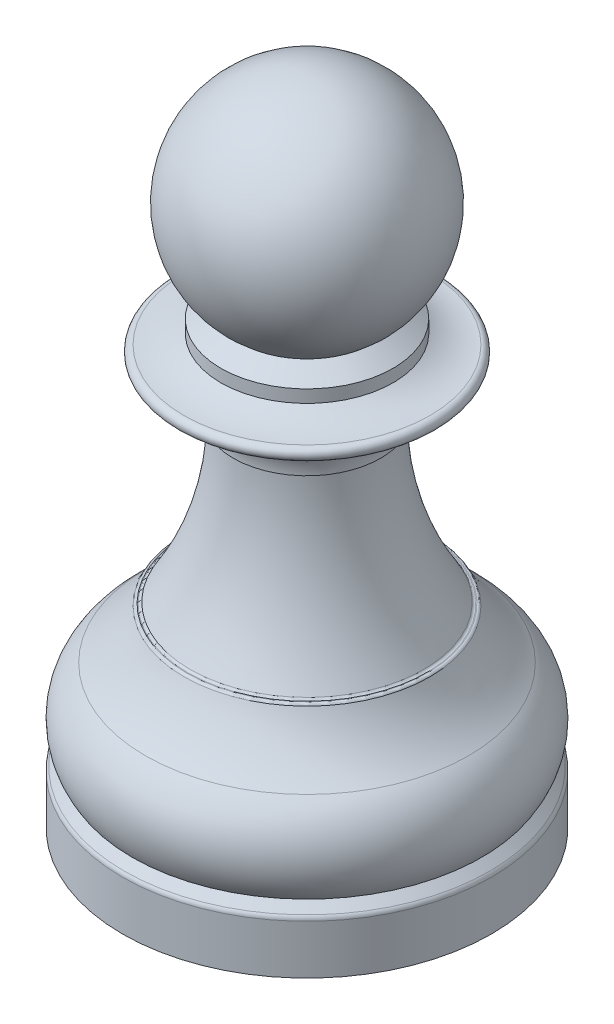
from build123d import *

# Parameters (mm, degrees)
SCALE2_SCALE       = 0.766666667
SKETCH2_R          = 10.2
CUT_EXTRUDE1_DEPTH = 8


with BuildPart() as part:
    # Sketch1 → Revolve1 (revolve)
    with BuildSketch(Plane.XY, mode=Mode.PRIVATE) as revolve1_sk:
        with BuildLine():
            Line((-15.0008, 4), (-15.0008, 0))
            Line((-15.0008, 0), (0, 0))
            Line((0, 0), (0, 53))
            ThreePointArc((0, 53), (-8.518072869, 46.905586789), (-5.5, 36.876096576))
            Line((-5.5, 36.876096576), (-7, 35.825785268))
            Line((-7, 35.825785268), (-7, 34.803847577))
            ThreePointArc((-7, 34.803847577), (-8.447085729, 34.204445042), (-10, 34))
            ThreePointArc((-10, 34), (-10.5, 33.5), (-10, 33))
            ThreePointArc((-10, 33), (-8.197089197, 32.570645969), (-6.781221904, 31.374756318))
            ThreePointArc((-6.781221904, 31.374756318), (-6.200321567, 30.249977523), (-6, 29))
            Line((-6, 29), (-5.75, 29))
            ThreePointArc((-5.75, 29), (-5.918561958, 26.110624511), (-6.421960889, 23.260450242))
            ThreePointArc((-6.421960889, 23.260450242), (-7.661665867, 19.442372993), (-9.5, 15.873744415))
            ThreePointArc((-9.5, 15.873744415), (-9.59085457, 15.787272908), (-9.712270825, 15.75580916))
            Line((-9.712270825, 15.75580916), (-9.772727273, 15.75580916))
            ThreePointArc((-9.772727273, 15.75580916), (-9.907750675, 15.716210398), (-10, 15.609958607))
            ThreePointArc((-10, 15.609958607), (-11.32842315, 13.42468716), (-13.12555, 11.605221731))
            ThreePointArc((-13.12555, 11.605221731), (-14.934993933, 8.510433694), (-14.207906855, 5))
            Line((-14.207906855, 5), (-14.854353411, 4.35355337))
            ThreePointArc((-14.854353411, 4.35355337), (-14.962739772, 4.191341703), (-15.0008, 4))
        make_face()
    revolve(revolve1_sk.sketch.rotate(Axis((0, 0, 0), (0, -1, 0)), 270), axis=Axis((0, 0, 0), (0, -1, 0)))


with BuildPart() as part_1:
    # Scale2: scaled about (0, 0, 0)
    add(part.part.scale(SCALE2_SCALE))

    # Sketch2 → Cut-Extrude1 (cut)
    with BuildSketch(Plane.XZ):
        with Locations(Location((0, 0, 0), (0, 0, 270))):
            Circle(SKETCH2_R)
    extrude(amount=-CUT_EXTRUDE1_DEPTH, mode=Mode.SUBTRACT)


solid = part_1.part
